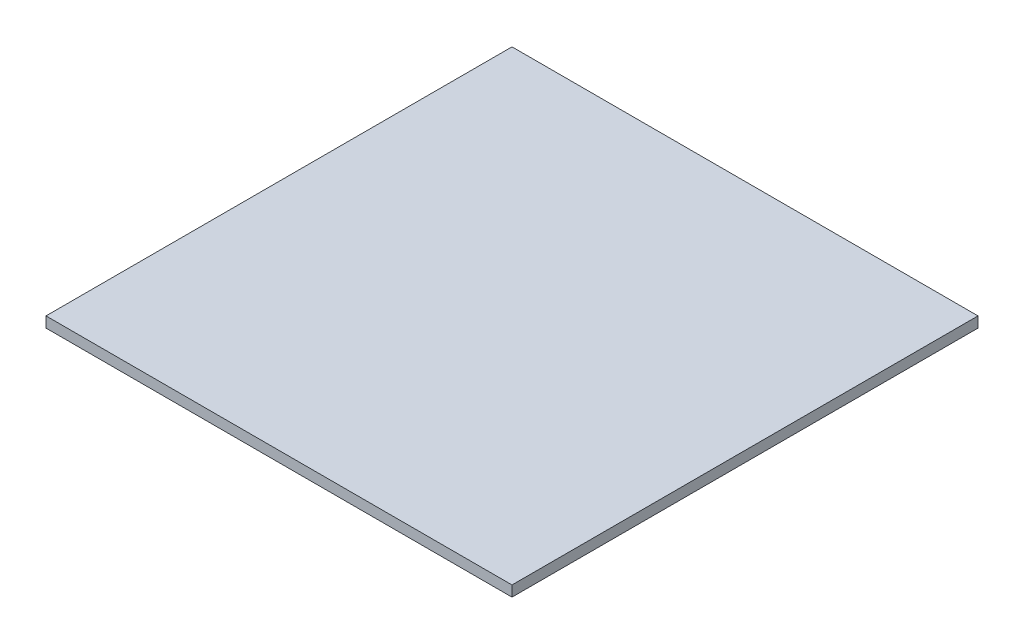
from build123d import *

# Parameters (mm, degrees)
SKETCH1_W           = 220
SKETCH1_H           = 220
BOSS_EXTRUDE1_DEPTH = 5


with BuildPart() as part:
    # Sketch1 → Boss-Extrude1 (new body)
    with BuildSketch(Plane(origin=(0, 0, 0), x_dir=(1, 0, 0), z_dir=(0, 1, 0))):
        Rectangle(SKETCH1_W, SKETCH1_H)
    extrude(amount=BOSS_EXTRUDE1_DEPTH)


solid = part.part
